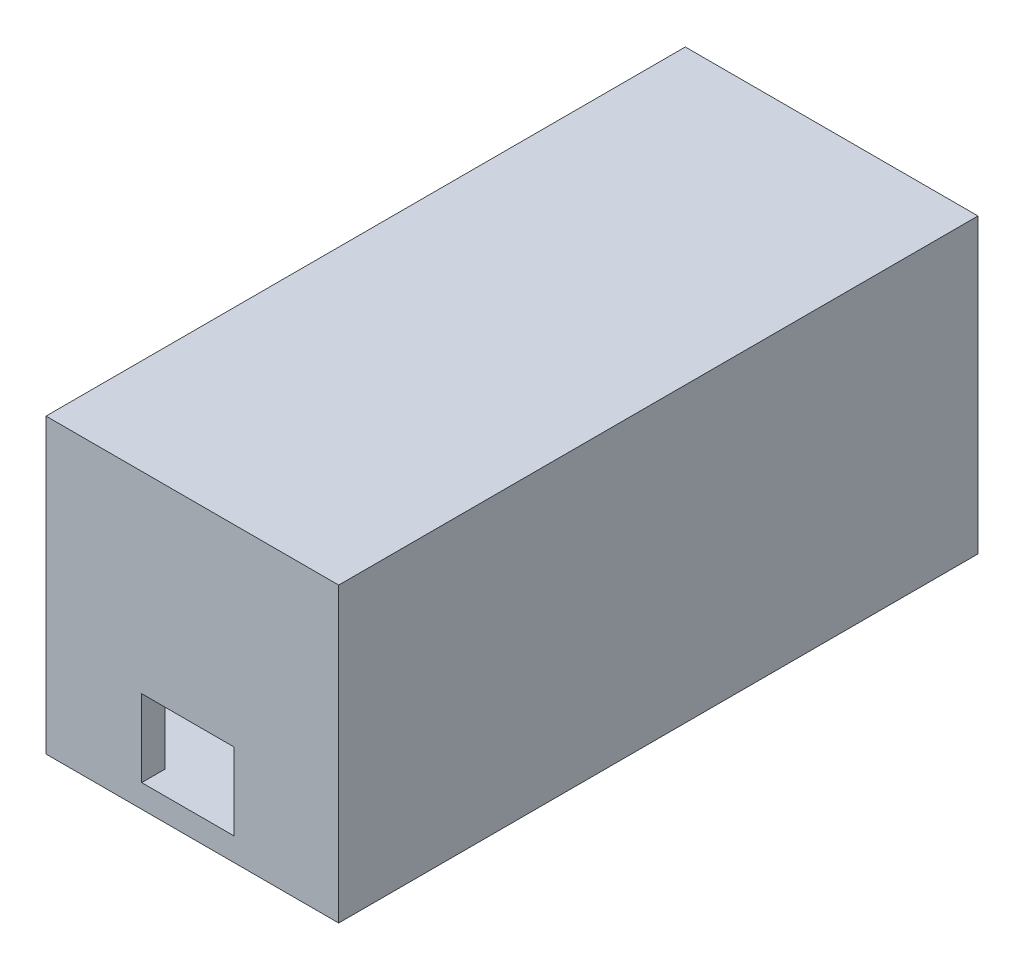
from build123d import *

# Parameters (mm, degrees)
SKETCH_1_W      = 19
SKETCH_1_H      = 19
SKETCH_1_W_2    = 16
SKETCH_1_H_2    = 16
EXTRUDE_1_DEPTH = 40
SKETCH_2_W      = 19
SKETCH_2_H      = 19
SKETCH_2_W_2    = 6
SKETCH_2_H_2    = 5
EXTRUDE_2_DEPTH = 1.5


with BuildPart() as part:
    # 草图1 → 凸台-拉伸1 (new body)
    with BuildSketch(Plane.XY):
        with Locations((9.5, 9.5)):
            Rectangle(SKETCH_1_W, SKETCH_1_H)
        with Locations((9.5, 9.5)):
            Rectangle(SKETCH_1_W_2, SKETCH_1_H_2, mode=Mode.SUBTRACT)
    extrude(amount=EXTRUDE_1_DEPTH)

    # 草图2 → 凸台-拉伸2 (add)
    with BuildSketch(Plane.XY.offset(40)):
        with Locations((9.5, 9.5)):
            Rectangle(SKETCH_2_W, SKETCH_2_H)
        with Locations((9.210992581, 4)):
            Rectangle(SKETCH_2_W_2, SKETCH_2_H_2, mode=Mode.SUBTRACT)
    extrude(amount=EXTRUDE_2_DEPTH)


solid = part.part
